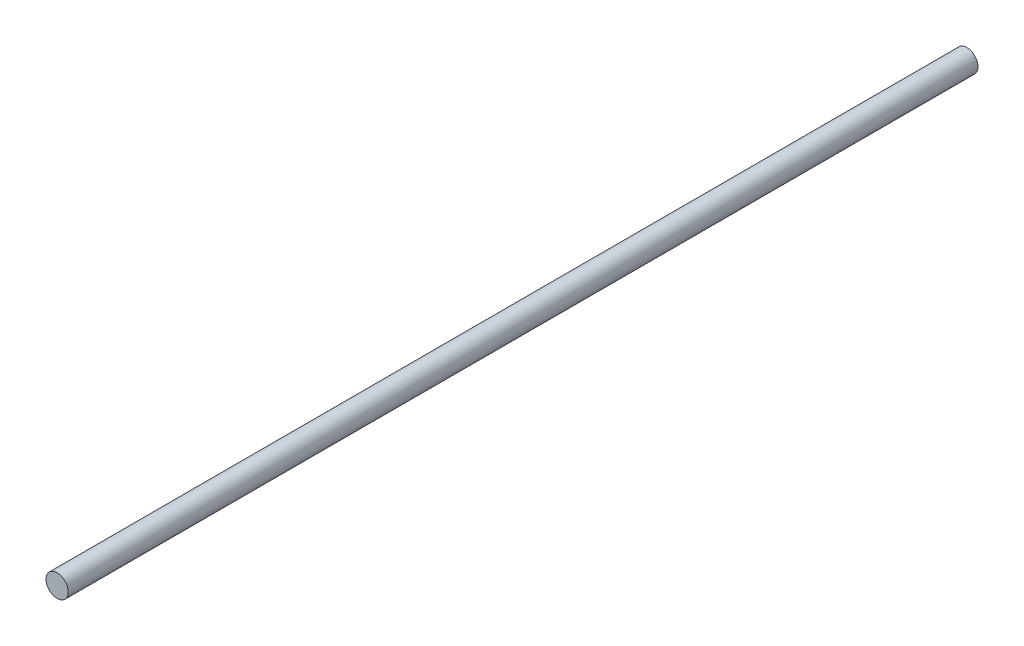
from build123d import *

# Parameters (mm, degrees)
SKETCH1_R           = 3
BOSS_EXTRUDE1_DEPTH = 245


with BuildPart() as part:
    # Sketch1 → Boss-Extrude1 (new body)
    with BuildSketch(Plane.XY):
        Circle(SKETCH1_R)
    extrude(amount=BOSS_EXTRUDE1_DEPTH)


solid = part.part
